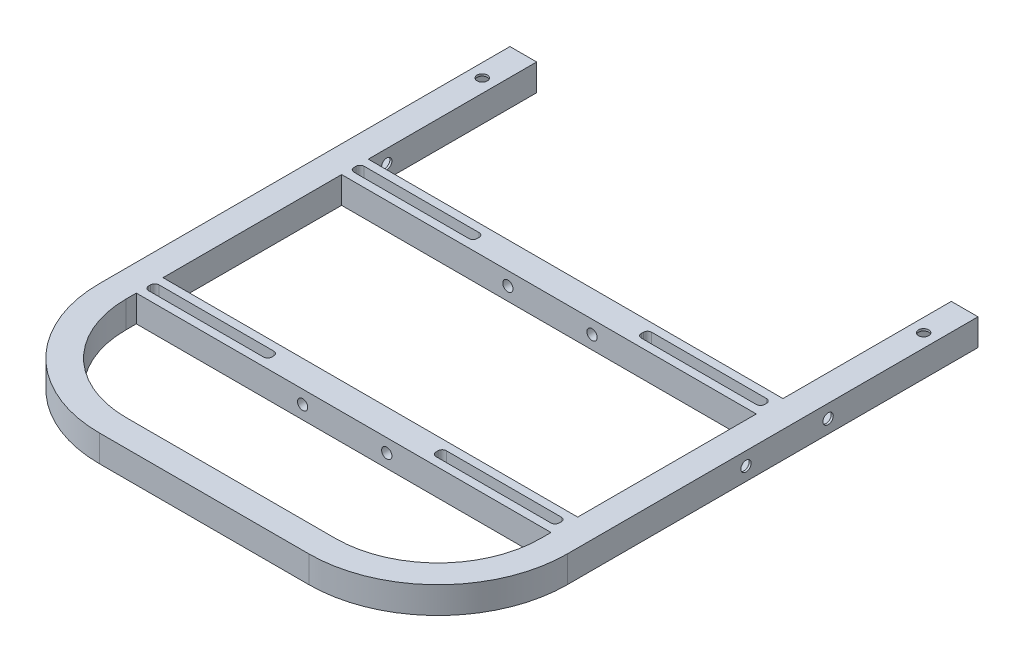
from build123d import *

# Parameters (mm, degrees)
BOSS_EXTRUDE1_DEPTH = 33.02
BOSS_EXTRUDE2_REACH = 840.177
SKETCH3_W           = 33.02
SKETCH3_H           = 33.02
CUT_EXTRUDE1_DEPTH  = 699.684702852
CUT_EXTRUDE2_REACH  = 548.478
SKETCH6_R           = 6.35
LPATTERN1_COUNT     = 2
LPATTERN1_PITCH     = 254
SHELL1_T            = -2.54
CUT_EXTRUDE3_REACH  = 730.825
SKETCH7_W           = 27.94
SKETCH7_H           = 27.94
CUT_EXTRUDE4_REACH  = 700.685
SKETCH8_R           = 6.35
CUT_EXTRUDE5_REACH  = 862.055
SKETCH9_R           = 6.35
CUT_EXTRUDE6_REACH  = 862.055
SKETCH10_R          = 6.35
SKETCH15_R          = 6.35
CUT_EXTRUDE10_DEPTH = 839.176908773
SKETCH16_R          = 6.35
CUT_EXTRUDE11_DEPTH = 861.055402169


with BuildPart() as part:
    # Sketch1 → Boss-Extrude1 (new body)
    with BuildSketch(Plane(origin=(0, 0, 0), x_dir=(1, 0, 0), z_dir=(0, 1, 0))):
        with BuildLine():
            Line((-256.54, 635), (-256.54, 127))
            ThreePointArc((-256.54, 127), (-219.342561211, 37.197438789), (-129.54, 0))
            Line((-129.54, 0), (129.54, 0))
            ThreePointArc((129.54, 0), (219.342561211, 37.197438789), (256.54, 127))
            Line((256.54, 127), (256.54, 635))
            Line((256.54, 635), (289.56, 635))
            Line((289.56, 635), (289.56, 127))
            ThreePointArc((289.56, 127), (242.691227125, 13.848772875), (129.54, -33.02))
            Line((129.54, -33.02), (-129.54, -33.02))
            ThreePointArc((-129.54, -33.02), (-242.691227125, 13.848772875), (-289.56, 127))
            Line((-289.56, 127), (-289.56, 635))
            Line((-289.56, 635), (-256.54, 635))
        make_face()
    extrude(amount=-BOSS_EXTRUDE1_DEPTH)

    # Sketch3 → Boss-Extrude2 (add, up to next)
    with BuildSketch(Plane(origin=(-256.54, 0, 0), x_dir=(0, 0, -1), z_dir=(1, 0, 0)), mode=Mode.PRIVATE) as boss_extrude2_sk1:
        with Locations((156.21, -16.51)):
            Rectangle(SKETCH3_W, SKETCH3_H)
    boss_extrude2_tool1 = extrude(boss_extrude2_sk1.sketch, amount=BOSS_EXTRUDE2_REACH, mode=Mode.PRIVATE) - part.part
    boss_extrude2 = boss_extrude2_tool1.solids().sort_by_distance((-256.54, -16.51, -156.21))[0]
    add(boss_extrude2)

    # Sketch5 → Cut-Extrude1 (cut, through all)
    with BuildSketch(Plane(origin=(0, 0, 0), x_dir=(1, 0, 0), z_dir=(0, 1, 0))):
        with BuildLine():
            Line((-251.46, 162.56), (-109.22, 162.56))
            ThreePointArc((-109.22, 162.56), (-105.627897552, 161.072102448), (-104.14, 157.48))
            Line((-104.14, 157.48), (-104.14, 154.94))
            ThreePointArc((-104.14, 154.94), (-105.627897552, 151.347897552), (-109.22, 149.86))
            Line((-109.22, 149.86), (-251.46, 149.86))
            ThreePointArc((-251.46, 149.86), (-255.052102448, 151.347897552), (-256.54, 154.94))
            Line((-256.54, 154.94), (-256.54, 157.48))
            ThreePointArc((-256.54, 157.48), (-255.052102448, 161.072102448), (-251.46, 162.56))
        make_face()
        with BuildLine():
            Line((99.06, 157.48), (99.06, 154.94))
            ThreePointArc((99.06, 154.94), (100.547897552, 151.347897552), (104.14, 149.86))
            Line((104.14, 149.86), (246.38, 149.86))
            ThreePointArc((246.38, 149.86), (249.972102448, 151.347897552), (251.46, 154.94))
            Line((251.46, 154.94), (251.46, 157.48))
            ThreePointArc((251.46, 157.48), (249.972102448, 161.072102448), (246.38, 162.56))
            Line((246.38, 162.56), (104.14, 162.56))
            ThreePointArc((104.14, 162.56), (100.547897552, 161.072102448), (99.06, 157.48))
        make_face()
    cut_extrude1 = extrude(amount=-CUT_EXTRUDE1_DEPTH, mode=Mode.SUBTRACT)

    # Sketch6 → Cut-Extrude2 (cut, up to next)
    with BuildSketch(Plane(origin=(0, 0, -172.72), x_dir=(-1, 0, 0), z_dir=(0, 0, -1)), mode=Mode.PRIVATE) as cut_extrude2_sk1:
        with Locations((50.8, -16.51)):
            Circle(SKETCH6_R)
    cut_extrude2_tool1 = extrude(cut_extrude2_sk1.sketch, amount=-CUT_EXTRUDE2_REACH, mode=Mode.PRIVATE) & part.part
    # Sketch6 → Cut-Extrude2 (cut, up to next)
    with BuildSketch(Plane(origin=(0, 0, -172.72), x_dir=(-1, 0, 0), z_dir=(0, 0, -1)), mode=Mode.PRIVATE) as cut_extrude2_sk2:
        with Locations((-53.34, -16.51)):
            Circle(SKETCH6_R)
    cut_extrude2_tool2 = extrude(cut_extrude2_sk2.sketch, amount=-CUT_EXTRUDE2_REACH, mode=Mode.PRIVATE) & part.part
    cut_extrude2_1 = cut_extrude2_tool1.solids().sort_by_distance((-50.8, -16.51, -172.72))[0]
    add(cut_extrude2_1, mode=Mode.SUBTRACT)
    cut_extrude2_2 = cut_extrude2_tool2.solids().sort_by_distance((53.34, -16.51, -172.72))[0]
    add(cut_extrude2_2, mode=Mode.SUBTRACT)
    cut_extrude2 = cut_extrude2_1 + cut_extrude2_2  # Cut-Extrude2 as one shape, for the pattern or mirror that repeats it

    # LPattern1: Boss-Extrude2, Cut-Extrude1, Cut-Extrude2 ×2
    with Locations(*[(0, 0, -i * LPATTERN1_PITCH) for i in range(1, LPATTERN1_COUNT)]):
        add(boss_extrude2)
        add(cut_extrude1, mode=Mode.SUBTRACT)
        add(cut_extrude2, mode=Mode.SUBTRACT)

    # Shell1
    shell1_openings = [part.faces().sort_by_distance(p)[0] for p in [
        (273.05, -16.51, -635),
    ]]
    offset(amount=SHELL1_T, openings=shell1_openings, kind=Kind.INTERSECTION)

    # Sketch7 → Cut-Extrude3 (cut, up to next)
    with BuildSketch(Plane(origin=(0, 0, -635), x_dir=(-1, 0, 0), z_dir=(0, 0, -1)), mode=Mode.PRIVATE) as cut_extrude3_sk1:
        with Locations((273.05, -16.51)):
            Rectangle(SKETCH7_W, SKETCH7_H)
    cut_extrude3_tool1 = extrude(cut_extrude3_sk1.sketch, amount=-CUT_EXTRUDE3_REACH, mode=Mode.PRIVATE) & part.part
    add(cut_extrude3_tool1.solids().sort_by_distance((-273.05, -16.51, -635))[0], mode=Mode.SUBTRACT)

    # Sketch8 → Cut-Extrude4 (cut, up to next)
    with BuildSketch(Plane(origin=(0, 0, 0), x_dir=(1, 0, 0), z_dir=(0, 1, 0)), mode=Mode.PRIVATE) as cut_extrude4_sk1:
        with Locations((-273.05, 584.2)):
            Circle(SKETCH8_R)
    cut_extrude4_tool1 = extrude(cut_extrude4_sk1.sketch, amount=-CUT_EXTRUDE4_REACH, mode=Mode.PRIVATE) & part.part
    # Sketch8 → Cut-Extrude4 (cut, up to next)
    with BuildSketch(Plane(origin=(0, 0, 0), x_dir=(1, 0, 0), z_dir=(0, 1, 0)), mode=Mode.PRIVATE) as cut_extrude4_sk2:
        with Locations((273.05, 584.2)):
            Circle(SKETCH8_R)
    cut_extrude4_tool2 = extrude(cut_extrude4_sk2.sketch, amount=-CUT_EXTRUDE4_REACH, mode=Mode.PRIVATE) & part.part
    add(cut_extrude4_tool1.solids().sort_by_distance((-273.05, 0, -584.2))[0], mode=Mode.SUBTRACT)
    add(cut_extrude4_tool2.solids().sort_by_distance((273.05, 0, -584.2))[0], mode=Mode.SUBTRACT)

    # Sketch9 → Cut-Extrude5 (cut, up to next)
    with BuildSketch(Plane(origin=(289.56, 0, 0), x_dir=(0, 0, -1), z_dir=(1, 0, 0)), mode=Mode.PRIVATE) as cut_extrude5_sk1:
        with Locations((347.98, -16.51)):
            Circle(SKETCH9_R)
    cut_extrude5_tool1 = extrude(cut_extrude5_sk1.sketch, amount=-CUT_EXTRUDE5_REACH, mode=Mode.PRIVATE) & part.part
    # Sketch9 → Cut-Extrude5 (cut, up to next)
    with BuildSketch(Plane(origin=(289.56, 0, 0), x_dir=(0, 0, -1), z_dir=(1, 0, 0)), mode=Mode.PRIVATE) as cut_extrude5_sk2:
        with Locations((449.58, -16.51)):
            Circle(SKETCH9_R)
    cut_extrude5_tool2 = extrude(cut_extrude5_sk2.sketch, amount=-CUT_EXTRUDE5_REACH, mode=Mode.PRIVATE) & part.part
    add(cut_extrude5_tool1.solids().sort_by_distance((289.56, -16.51, -347.98))[0], mode=Mode.SUBTRACT)
    add(cut_extrude5_tool2.solids().sort_by_distance((289.56, -16.51, -449.58))[0], mode=Mode.SUBTRACT)

    # Sketch10 → Cut-Extrude6 (cut, up to next)
    with BuildSketch(Plane.ZY.offset(289.56), mode=Mode.PRIVATE) as cut_extrude6_sk1:
        with Locations((-347.98, -16.51)):
            Circle(SKETCH10_R)
    cut_extrude6_tool1 = extrude(cut_extrude6_sk1.sketch, amount=-CUT_EXTRUDE6_REACH, mode=Mode.PRIVATE) & part.part
    add(cut_extrude6_tool1.solids().sort_by_distance((-289.56, -16.51, -347.98))[0], mode=Mode.SUBTRACT)

    # Sketch15 → Cut-Extrude10 (cut, through all)
    with BuildSketch(Plane.ZY.offset(-256.54)):
        with Locations((-449.58, -16.51)):
            Circle(SKETCH15_R)
    extrude(amount=-CUT_EXTRUDE10_DEPTH, mode=Mode.SUBTRACT)

    # Sketch16 → Cut-Extrude11 (cut, through all)
    with BuildSketch(Plane.ZY.offset(289.56)):
        with Locations((-449.58, -16.51)):
            Circle(SKETCH16_R)
    extrude(amount=-CUT_EXTRUDE11_DEPTH, mode=Mode.SUBTRACT)


solid = part.part
